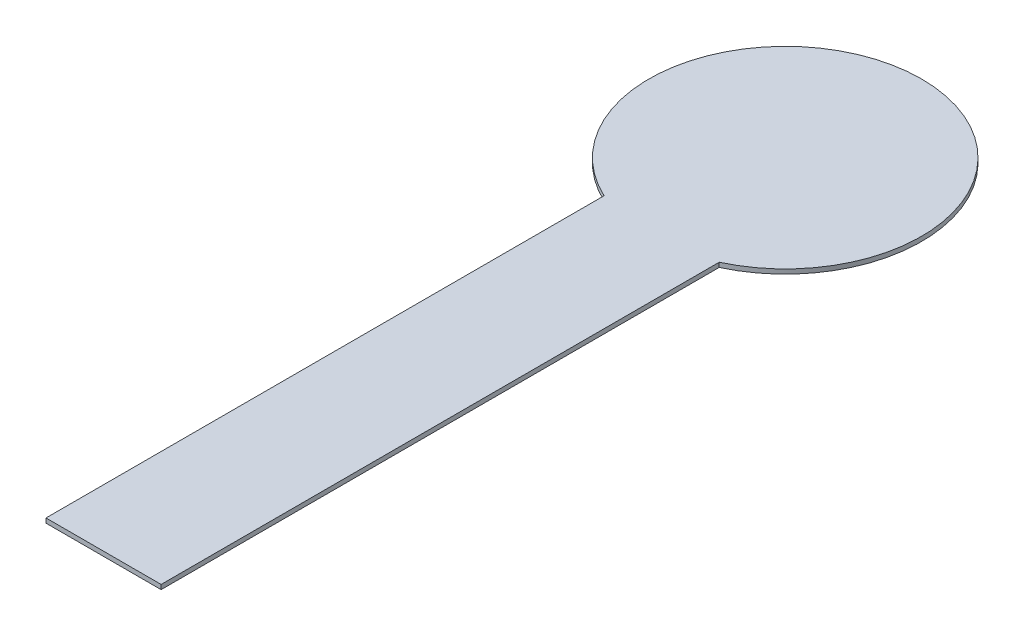
from build123d import *

# Parameters (mm, degrees)
BOSS_EXTRUDE1_DEPTH = 0.3


with BuildPart() as part:
    # Sketch2 → Boss-Extrude1 (new body)
    with BuildSketch(Plane(origin=(0, 0, 0), x_dir=(1, 0, 0), z_dir=(0, 1, 0))):
        with BuildLine():
            Line((-3.8, -8.158431222), (-3.8, -45))
            Line((-3.8, -45), (3.8, -45))
            Line((3.8, -45), (3.8, -8.158431222))
            ThreePointArc((3.8, -8.158431222), (0, 9), (-3.8, -8.158431222))
        make_face()
    extrude(amount=-BOSS_EXTRUDE1_DEPTH)


solid = part.part
